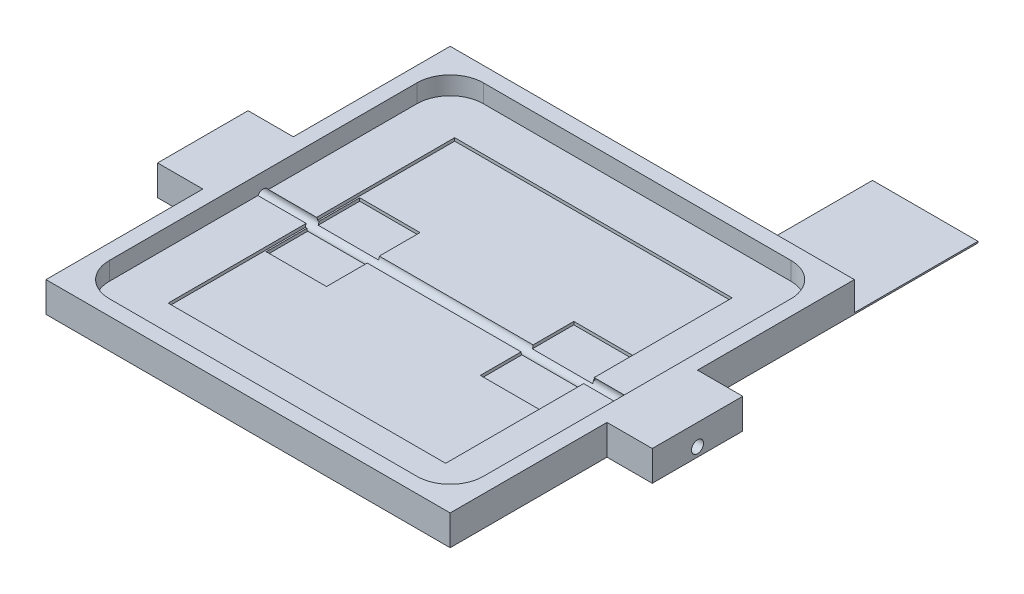
from build123d import *

# Parameters (mm, degrees)
BOSS_EXTRUDE1_DEPTH = 10
SKETCH9_R           = 2
CUT_EXTRUDE14_DEPTH = 181
SKETCH2_W           = 124
SKETCH2_H           = 124
CUT_EXTRUDE15_DEPTH = 6
SKETCH10_W          = 20
SKETCH10_H          = 31
CUT_EXTRUDE17_DEPTH = 2
SKETCH11_W          = 92
SKETCH11_H          = 95
CUT_EXTRUDE18_DEPTH = 1
FILLET3_R           = 11
SKETCH13_W          = 34.982721691
SKETCH13_H          = 0.5
BOSS_EXTRUDE3_DEPTH = 41


with BuildPart() as part:
    # Sketch1 → Boss-Extrude1 (new body)
    with BuildSketch(Plane(origin=(0, 0, 0), x_dir=(1, 0, 0), z_dir=(0, 1, 0))):
        Polygon((-67, -15), (-67, -67), (67, -67), (67, -15), (82, -15), (82, 15), (67, 15), (67, 67), (-67, 67), (-67, 15), (-82, 15), (-82, -15), align=None)
    extrude(amount=BOSS_EXTRUDE1_DEPTH)

    # Sketch9 → Cut-Extrude14 (cut)
    with BuildSketch(Plane(origin=(82, 0, 0), x_dir=(0, 0, -1), z_dir=(1, 0, 0))):
        with Locations((0, 3)):
            Circle(SKETCH9_R)
    extrude(amount=-CUT_EXTRUDE14_DEPTH, mode=Mode.SUBTRACT)

    # Sketch2 → Cut-Extrude15 (cut)
    with BuildSketch(Plane(origin=(0, 10, 0), x_dir=(1, 0, 0), z_dir=(0, 1, 0))):
        Rectangle(SKETCH2_W, SKETCH2_H)
    extrude(amount=-CUT_EXTRUDE15_DEPTH, mode=Mode.SUBTRACT)

    # Sketch10 → Cut-Extrude17 (cut)
    with BuildSketch(Plane(origin=(0, 4, 0), x_dir=(1, 0, 0), z_dir=(0, 1, 0))):
        with Locations((35.5, 0)):
            Rectangle(SKETCH10_W, SKETCH10_H)
        with Locations((-35.5, 0)):
            Rectangle(SKETCH10_W, SKETCH10_H)
    extrude(amount=-CUT_EXTRUDE17_DEPTH, mode=Mode.SUBTRACT)

    # Sketch11 → Cut-Extrude18 (cut)
    with BuildSketch(Plane(origin=(0, 4, 0), x_dir=(1, 0, 0), z_dir=(0, 1, 0))):
        Rectangle(SKETCH11_W, SKETCH11_H)
    extrude(amount=-CUT_EXTRUDE18_DEPTH, mode=Mode.SUBTRACT)

    # Fillet3
    fillet3_edges = [part.edges().sort_by_distance(p)[0] for p in [
        (62, 7, -62),
        (-62, 7, 62),
        (62, 7, 62),
        (-62, 7, -62),
    ]]
    fillet(fillet3_edges, radius=FILLET3_R)

    # Sketch13 → Boss-Extrude3 (add)
    with BuildSketch(Plane(origin=(0, 0, -67), x_dir=(-1, 0, 0), z_dir=(0, 0, -1))):
        with Locations((-49.508639155, 0.25)):
            Rectangle(SKETCH13_W, SKETCH13_H)
    extrude(amount=BOSS_EXTRUDE3_DEPTH)


solid = part.part
